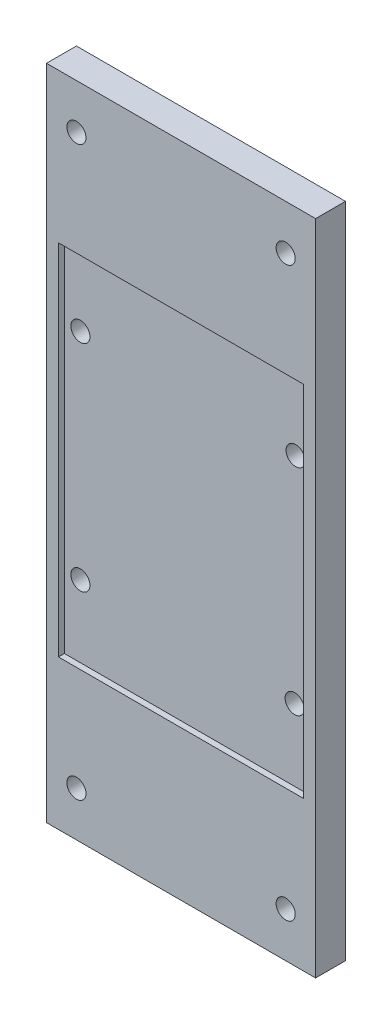
from build123d import *

# Parameters (mm, degrees)
SKETCH_1_W          = 45
SKETCH_1_H          = 100
EXTRUDE_1_DEPTH     = 5
SKETCH_2_W          = 41
SKETCH_2_H          = 60
CUT_EXTRUDE_1_DEPTH = 1
SKETCH_5_W          = 45
SKETCH_5_H          = 5
EXTRUDE_2_DEPTH     = 5
SKETCH_4_R          = 1.6
CUT_EXTRUDE_4_DEPTH = 10
SKETCH_3_R          = 1.6
CUT_EXTRUDE_7_DEPTH = 10


with BuildPart() as part:
    # 草图1 → 凸台-拉伸1 (new body)
    with BuildSketch(Plane.XY):
        Rectangle(SKETCH_1_W, SKETCH_1_H)
    extrude(amount=EXTRUDE_1_DEPTH)

    # 草图2 → 切除-拉伸1 (cut)
    with BuildSketch(Plane.XY.offset(5)):
        Rectangle(SKETCH_2_W, SKETCH_2_H)
    extrude(amount=-CUT_EXTRUDE_1_DEPTH, mode=Mode.SUBTRACT)

    # 草图5 → 凸台-拉伸2 (add)
    with BuildSketch(Plane.XY.offset(5)):
        with Locations((0, 52.5)):
            Rectangle(SKETCH_5_W, SKETCH_5_H)
        with Locations((0, -52.5)):
            Rectangle(SKETCH_5_W, SKETCH_5_H)
    extrude(amount=-EXTRUDE_2_DEPTH)

    # 草图4 → 切除-拉伸4 (cut)
    with BuildSketch(Plane.XY.offset(5)):
        with Locations((-17.5, 47.5)):
            Circle(SKETCH_4_R)
        with Locations((17.5, 47.5)):
            Circle(SKETCH_4_R)
        with Locations((-17.5, -47.5)):
            Circle(SKETCH_4_R)
        with Locations((17.5, -47.5)):
            Circle(SKETCH_4_R)
    extrude(amount=-CUT_EXTRUDE_4_DEPTH, mode=Mode.SUBTRACT)

    # 草图3 → 切除-拉伸7 (cut)
    with BuildSketch(Plane.XY.offset(4)):
        with BuildLine():
            ThreePointArc((-17.833531825, 16.4), (-16.702160975, 16.86862915), (-16.233531825, 18))
            Line((-16.233531825, 18), (-17.833531825, 18))
            Line((-17.833531825, 18), (-17.833531825, 16.4))
        make_face()
        with BuildLine():
            Line((-17.833531825, 18), (-16.233531825, 18))
            ThreePointArc((-16.233531825, 18), (-18.964902675, 19.13137085), (-17.833531825, 16.4))
            Line((-17.833531825, 16.4), (-17.833531825, 18))
        make_face()
        with Locations((-17.833531825, -18)):
            Circle(SKETCH_3_R)
        with Locations((18, -18)):
            Circle(SKETCH_3_R)
        with Locations((18.166468175, 18)):
            Circle(SKETCH_3_R)
    extrude(amount=-CUT_EXTRUDE_7_DEPTH, mode=Mode.SUBTRACT)


solid = part.part
